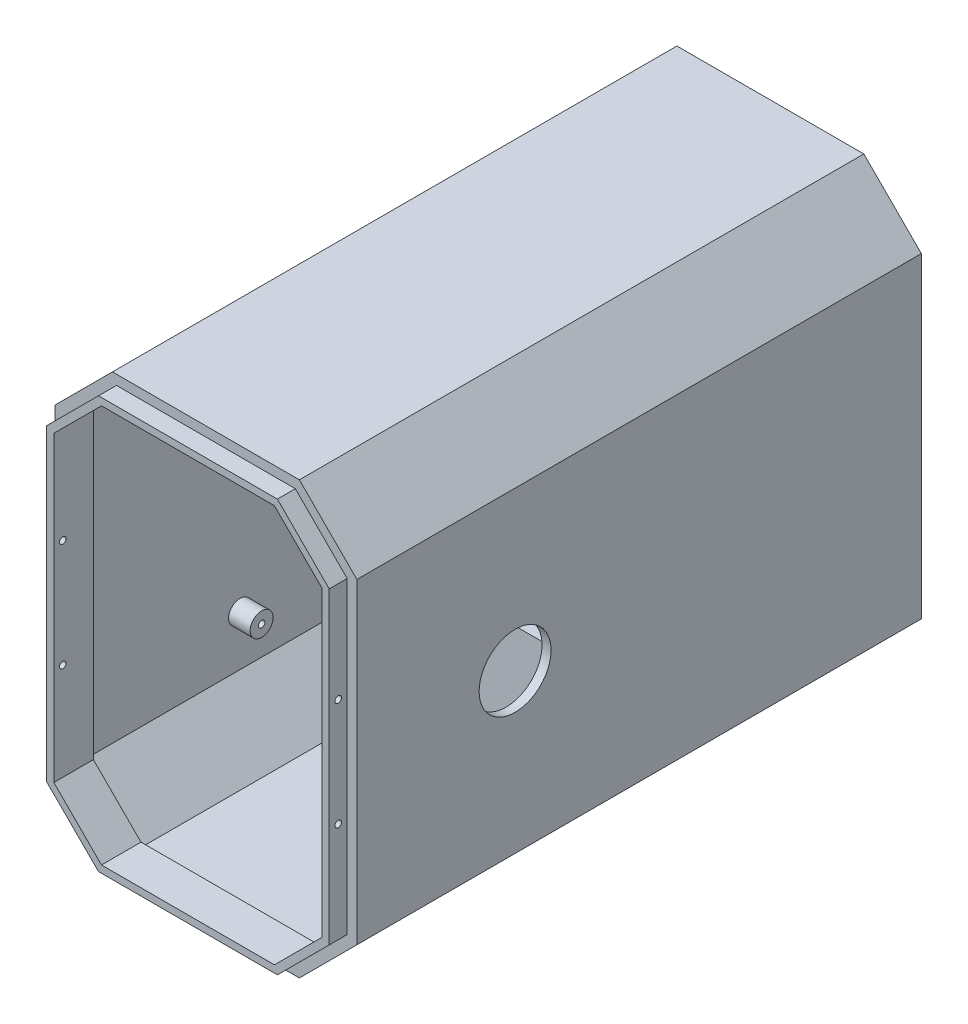
from build123d import *

# Parameters (mm, degrees)
BOSS_1_DEPTH   = 157
CUT_2_DEPTH    = 122.675
CUT_3_DEPTH    = 32.025
S_CUT4_W       = 8
S_CUT4_H       = 28
POCKET_4_DEPTH = 2.7
S_HOLE5_R      = 6
HOLE_5_DEPTH   = 2.7
S_CUT6_W       = 19.4
S_CUT6_H       = 6.3
POCKET_6_DEPTH = 2.7
S_CUT7_W       = 19.4
S_CUT7_H       = 6.3
POCKET_7_DEPTH = 2.7
S_HOLE8_R      = 1.7
HOLE_8_DEPTH   = 2.7
S_HOLE9_R      = 1.7
HOLE_9_DEPTH   = 2.7
S_HOLE10_R     = 1.7
HOLE_10_DEPTH  = 2.7
S_HOLE11_R     = 1.7
HOLE_11_DEPTH  = 2.7
BOSS_12_DEPTH  = 6
BOSS_13_DEPTH  = 5.1
S_CYL14_R      = 3.2
BOSS_14_DEPTH  = 6.5
S_CYL15_R      = 3.2
BOSS_15_DEPTH  = 6.5
S_CYL16_R      = 3.2
BOSS_16_DEPTH  = 6.5
S_CYL17_R      = 3.2
BOSS_17_DEPTH  = 6.5
S_BOX18_W      = 25.8
S_BOX18_H      = 27.5
BOSS_18_DEPTH  = 6
S_BOX19_W      = 25.8
S_BOX19_H      = 27.5
BOSS_19_DEPTH  = 6
S_BOX20_W      = 25.8
S_BOX20_H      = 69
BOSS_20_DEPTH  = 6
CUT_21_DEPTH   = 11.2
S_HOLE22_R     = 0.9
HOLE_22_DEPTH  = 2.7
S_HOLE23_R     = 0.9
HOLE_23_DEPTH  = 2.7
S_HOLE24_R     = 0.9
HOLE_24_DEPTH  = 2.7
S_HOLE25_R     = 0.9
HOLE_25_DEPTH  = 2.7
S_HOLE26_R     = 0.9
HOLE_26_DEPTH  = 7.2
S_HOLE27_R     = 0.9
HOLE_27_DEPTH  = 7.2
S_HOLE28_R     = 0.9
HOLE_28_DEPTH  = 7.2
S_HOLE29_R     = 0.9
HOLE_29_DEPTH  = 7.2
S_HOLE30_R     = 10
HOLE_30_DEPTH  = 3.1
S_HOLE31_R     = 0.9
HOLE_31_DEPTH  = 9.1
S_HOLE32_R     = 0.9
HOLE_32_DEPTH  = 9.1
S_HOLE33_R     = 0.9
HOLE_33_DEPTH  = 9.1
S_HOLE34_R     = 0.9
HOLE_34_DEPTH  = 9.1


with BuildPart() as part:
    # S_prism1 → Boss_1 (new body)
    with BuildSketch(Plane.XY.offset(37)):
        Polygon((42, -44), (42, 44), (26, 60), (-26, 60), (-42, 44), (-42, -44), (-26, -60), (26, -60), align=None)
    extrude(amount=BOSS_1_DEPTH)

    # S_pcut2 → Cut_2 (cut)
    with BuildSketch(Plane.XY.offset(71.425)):
        Polygon((39.5, -42.964466094), (39.5, 42.964466094), (24.964466094, 57.5), (-24.964466094, 57.5), (-39.5, 42.964466094), (-39.5, -42.964466094), (-24.964466094, -57.5), (24.964466094, -57.5), align=None)
    extrude(amount=CUT_2_DEPTH, mode=Mode.SUBTRACT)

    # S_pcut3 → Cut_3 (cut)
    with BuildSketch(Plane.XY.offset(36.9)):
        Polygon((39.5, -42.964466094), (39.5, 42.964466094), (24.964466094, 57.5), (-24.964466094, 57.5), (-39.5, 42.964466094), (-39.5, -42.964466094), (-24.964466094, -57.5), (24.964466094, -57.5), align=None)
    extrude(amount=CUT_3_DEPTH, mode=Mode.SUBTRACT)

    # S_cut4 → Pocket_4 (cut)
    with BuildSketch(Plane.XY.offset(68.825)):
        with Locations((-30, 0)):
            Rectangle(S_CUT4_W, S_CUT4_H)
    extrude(amount=POCKET_4_DEPTH, mode=Mode.SUBTRACT)

    # S_hole5 → Hole_5 (cut)
    with BuildSketch(Plane(origin=(-42.1, 0, 0), x_dir=(0, 0, -1), z_dir=(1, 0, 0))):
        with Locations((-88, 0)):
            Circle(S_HOLE5_R)
    extrude(amount=HOLE_5_DEPTH, mode=Mode.SUBTRACT)

    # S_cut6 → Pocket_6 (cut)
    with BuildSketch(Plane.XY.offset(68.825)):
        with Locations((0, 30.95)):
            Rectangle(S_CUT6_W, S_CUT6_H)
    extrude(amount=POCKET_6_DEPTH, mode=Mode.SUBTRACT)

    # S_cut7 → Pocket_7 (cut)
    with BuildSketch(Plane.XY.offset(68.825)):
        with Locations((0, -30.95)):
            Rectangle(S_CUT7_W, S_CUT7_H)
    extrude(amount=POCKET_7_DEPTH, mode=Mode.SUBTRACT)

    # S_hole8 → Hole_8 (cut)
    with BuildSketch(Plane.XY.offset(68.825)):
        with Locations((-20, -25)):
            Circle(S_HOLE8_R)
    extrude(amount=HOLE_8_DEPTH, mode=Mode.SUBTRACT)

    # S_hole9 → Hole_9 (cut)
    with BuildSketch(Plane.XY.offset(68.825)):
        with Locations((-20, 25)):
            Circle(S_HOLE9_R)
    extrude(amount=HOLE_9_DEPTH, mode=Mode.SUBTRACT)

    # S_hole10 → Hole_10 (cut)
    with BuildSketch(Plane.XY.offset(68.825)):
        with Locations((24, -25)):
            Circle(S_HOLE10_R)
    extrude(amount=HOLE_10_DEPTH, mode=Mode.SUBTRACT)

    # S_hole11 → Hole_11 (cut)
    with BuildSketch(Plane.XY.offset(68.825)):
        with Locations((24, 25)):
            Circle(S_HOLE11_R)
    extrude(amount=HOLE_11_DEPTH, mode=Mode.SUBTRACT)

    # S_prism12 → Boss_12 (add)
    with BuildSketch(Plane.XY.offset(188)):
        Polygon((40, -43.171572875), (40, 43.171572875), (25.171572875, 58), (-25.171572875, 58), (-40, 43.171572875), (-40, -43.171572875), (-25.171572875, -58), (25.171572875, -58), align=None)
    extrude(amount=BOSS_12_DEPTH)

    # S_prism13 → Boss_13 (add)
    with BuildSketch(Plane.XY.offset(193.9)):
        Polygon((39.3, -42.881623382), (39.3, 42.881623382), (24.881623382, 57.3), (-24.881623382, 57.3), (-39.3, 42.881623382), (-39.3, -42.881623382), (-24.881623382, -57.3), (24.881623382, -57.3), align=None)
    extrude(amount=BOSS_13_DEPTH)

    # S_cyl14 → Boss_14 (add)
    with BuildSketch(Plane(origin=(-40, 0, 0), x_dir=(0, 0, -1), z_dir=(1, 0, 0))):
        with Locations((-96, -29)):
            Circle(S_CYL14_R)
    extrude(amount=BOSS_14_DEPTH)

    # S_cyl15 → Boss_15 (add)
    with BuildSketch(Plane(origin=(-40, 0, 0), x_dir=(0, 0, -1), z_dir=(1, 0, 0))):
        with Locations((-145, -29)):
            Circle(S_CYL15_R)
    extrude(amount=BOSS_15_DEPTH)

    # S_cyl16 → Boss_16 (add)
    with BuildSketch(Plane(origin=(-40, 0, 0), x_dir=(0, 0, -1), z_dir=(1, 0, 0))):
        with Locations((-96, 29)):
            Circle(S_CYL16_R)
    extrude(amount=BOSS_16_DEPTH)

    # S_cyl17 → Boss_17 (add)
    with BuildSketch(Plane(origin=(-40, 0, 0), x_dir=(0, 0, -1), z_dir=(1, 0, 0))):
        with Locations((-145, 29)):
            Circle(S_CYL17_R)
    extrude(amount=BOSS_17_DEPTH)

    # S_box18 → Boss_18 (add)
    with BuildSketch(Plane.XY.offset(126.2)):
        with Locations((27.1, -20.75)):
            Rectangle(S_BOX18_W, S_BOX18_H)
    extrude(amount=BOSS_18_DEPTH)

    # S_box19 → Boss_19 (add)
    with BuildSketch(Plane.XY.offset(126.2)):
        with Locations((27.1, 20.75)):
            Rectangle(S_BOX19_W, S_BOX19_H)
    extrude(amount=BOSS_19_DEPTH)

    # S_box20 → Boss_20 (add)
    with BuildSketch(Plane.XY.offset(167.8)):
        with Locations((27.1, 0)):
            Rectangle(S_BOX20_W, S_BOX20_H)
    extrude(amount=BOSS_20_DEPTH)

    # S_pcut21 → Cut_21 (cut)
    with BuildSketch(Plane.XY.offset(187.9)):
        Polygon((37.3, -42.053196257), (37.3, 42.053196257), (24.053196257, 55.3), (-24.053196257, 55.3), (-37.3, 42.053196257), (-37.3, -42.053196257), (-24.053196257, -55.3), (24.053196257, -55.3), align=None)
    extrude(amount=CUT_21_DEPTH, mode=Mode.SUBTRACT)

    # S_hole22 → Hole_22 (cut)
    with BuildSketch(Plane(origin=(37.1, 0, 0), x_dir=(0, 0, -1), z_dir=(1, 0, 0))):
        with Locations((-196.5, -15)):
            Circle(S_HOLE22_R)
    extrude(amount=HOLE_22_DEPTH, mode=Mode.SUBTRACT)

    # S_hole23 → Hole_23 (cut)
    with BuildSketch(Plane(origin=(37.1, 0, 0), x_dir=(0, 0, -1), z_dir=(1, 0, 0))):
        with Locations((-196.5, 15)):
            Circle(S_HOLE23_R)
    extrude(amount=HOLE_23_DEPTH, mode=Mode.SUBTRACT)

    # S_hole24 → Hole_24 (cut)
    with BuildSketch(Plane(origin=(-39.8, 0, 0), x_dir=(0, 0, -1), z_dir=(1, 0, 0))):
        with Locations((-196.5, -15)):
            Circle(S_HOLE24_R)
    extrude(amount=HOLE_24_DEPTH, mode=Mode.SUBTRACT)

    # S_hole25 → Hole_25 (cut)
    with BuildSketch(Plane(origin=(-39.8, 0, 0), x_dir=(0, 0, -1), z_dir=(1, 0, 0))):
        with Locations((-196.5, 15)):
            Circle(S_HOLE25_R)
    extrude(amount=HOLE_25_DEPTH, mode=Mode.SUBTRACT)

    # S_hole26 → Hole_26 (cut)
    with BuildSketch(Plane(origin=(-40.6, 0, 0), x_dir=(0, 0, -1), z_dir=(1, 0, 0))):
        with Locations((-96, -29)):
            Circle(S_HOLE26_R)
    extrude(amount=HOLE_26_DEPTH, mode=Mode.SUBTRACT)

    # S_hole27 → Hole_27 (cut)
    with BuildSketch(Plane(origin=(-40.6, 0, 0), x_dir=(0, 0, -1), z_dir=(1, 0, 0))):
        with Locations((-145, -29)):
            Circle(S_HOLE27_R)
    extrude(amount=HOLE_27_DEPTH, mode=Mode.SUBTRACT)

    # S_hole28 → Hole_28 (cut)
    with BuildSketch(Plane(origin=(-40.6, 0, 0), x_dir=(0, 0, -1), z_dir=(1, 0, 0))):
        with Locations((-96, 29)):
            Circle(S_HOLE28_R)
    extrude(amount=HOLE_28_DEPTH, mode=Mode.SUBTRACT)

    # S_hole29 → Hole_29 (cut)
    with BuildSketch(Plane(origin=(-40.6, 0, 0), x_dir=(0, 0, -1), z_dir=(1, 0, 0))):
        with Locations((-145, 29)):
            Circle(S_HOLE29_R)
    extrude(amount=HOLE_29_DEPTH, mode=Mode.SUBTRACT)

    # S_hole30 → Hole_30 (cut)
    with BuildSketch(Plane(origin=(39, 0, 0), x_dir=(0, 0, -1), z_dir=(1, 0, 0))):
        with Locations((-150, 0)):
            Circle(S_HOLE30_R)
    extrude(amount=HOLE_30_DEPTH, mode=Mode.SUBTRACT)

    # S_hole31 → Hole_31 (cut)
    with BuildSketch(Plane(origin=(14.1, 0, 0), x_dir=(0, 0, -1), z_dir=(1, 0, 0))):
        with Locations((-129.2, -22)):
            Circle(S_HOLE31_R)
    extrude(amount=HOLE_31_DEPTH, mode=Mode.SUBTRACT)

    # S_hole32 → Hole_32 (cut)
    with BuildSketch(Plane(origin=(14.1, 0, 0), x_dir=(0, 0, -1), z_dir=(1, 0, 0))):
        with Locations((-170.8, -22)):
            Circle(S_HOLE32_R)
    extrude(amount=HOLE_32_DEPTH, mode=Mode.SUBTRACT)

    # S_hole33 → Hole_33 (cut)
    with BuildSketch(Plane(origin=(14.1, 0, 0), x_dir=(0, 0, -1), z_dir=(1, 0, 0))):
        with Locations((-129.2, 22)):
            Circle(S_HOLE33_R)
    extrude(amount=HOLE_33_DEPTH, mode=Mode.SUBTRACT)

    # S_hole34 → Hole_34 (cut)
    with BuildSketch(Plane(origin=(14.1, 0, 0), x_dir=(0, 0, -1), z_dir=(1, 0, 0))):
        with Locations((-170.8, 22)):
            Circle(S_HOLE34_R)
    extrude(amount=HOLE_34_DEPTH, mode=Mode.SUBTRACT)


solid = part.part
